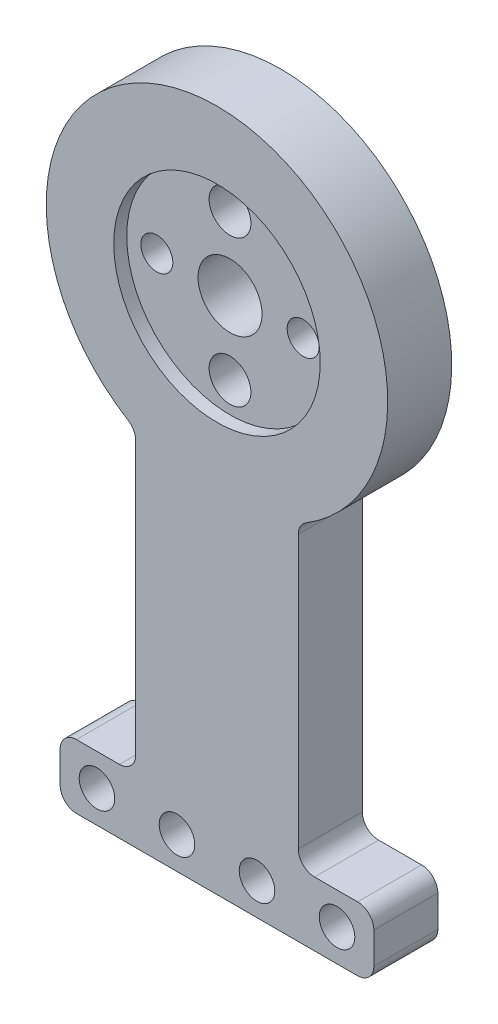
from build123d import *

# Parameters (mm, degrees)
SKETCH1_R                                           = 4.9975
BOSS_EXTRUDE1_DEPTH                                 = 4.999999995
SKETCH5_R                                           = 16.129
CUT_EXTRUDE2_DEPTH                                  = 2.032
F_5_0MM_DOWEL_HOLE1_D                               = 5
F_5_0MM_DOWEL_HOLE1_DEPTH                           = 16.51
F_5_0MM_DOWEL_HOLE1_TIP                             = 1.502151548
CSK_FOR_1_4_FLAT_HEAD_MACHINE_SCREW_100_D           = 6.5278
CSK_FOR_1_4_FLAT_HEAD_MACHINE_SCREW_100_DEPTH       = 16.51
CSK_FOR_1_4_FLAT_HEAD_MACHINE_SCREW_100_CSINK_D     = 12.8778
CSK_FOR_1_4_FLAT_HEAD_MACHINE_SCREW_100_CSINK_ANGLE = 100
CSK_FOR_1_4_FLAT_HEAD_MACHINE_SCREW_100_TIP         = 1.961148974
SKETCH26_W                                          = 9.99999999
SKETCH26_H                                          = 10.000000066
BOSS_EXTRUDE2_DEPTH                                 = 24.500000022
FILLET1_R                                           = 2.54
F_7_32_0_21875_DIAMETER_HOLE1_D                     = 5.55625
F_7_32_0_21875_DIAMETER_HOLE1_DEPTH                 = 16.51
F_7_32_0_21875_DIAMETER_HOLE1_TIP                   = 1.669265907


with BuildPart() as part:
    # Sketch1 → Boss-Extrude1 (new, symmetric)
    with BuildSketch(Plane.XY):
        with BuildLine():
            Line((-12.7, -80.01), (12.7, -80.01))
            Line((12.7, -80.01), (12.7, -23.452055347))
            ThreePointArc((12.7, -23.452055347), (0, 26.67), (-12.7, -23.452055347))
            Line((-12.7, -23.452055347), (-12.7, -80.01))
        make_face()
        Circle(SKETCH1_R, mode=Mode.SUBTRACT)
    extrude(amount=BOSS_EXTRUDE1_DEPTH, both=True)

    # Sketch5 → Cut-Extrude2 (cut)
    with BuildSketch(Plane.XY.offset(4.999999995)):
        Circle(SKETCH5_R)
    extrude(amount=-CUT_EXTRUDE2_DEPTH, mode=Mode.SUBTRACT)

    # Ø5.0mm Dowel Hole1
    with Locations(Plane(origin=(11.43, 0, -4.999999995), x_dir=(-1, 0, 0), z_dir=(0, 0, -1))):
        with Locations((0, 0), (22.86, 0)):
            Hole(F_5_0MM_DOWEL_HOLE1_D / 2, depth=F_5_0MM_DOWEL_HOLE1_DEPTH)
            with Locations((0, 0, -(F_5_0MM_DOWEL_HOLE1_DEPTH + F_5_0MM_DOWEL_HOLE1_TIP / 2))):  # 118° drill point
                Cone(0, F_5_0MM_DOWEL_HOLE1_D / 2, F_5_0MM_DOWEL_HOLE1_TIP, mode=Mode.SUBTRACT)

    # CSK for 1/4 Flat Head Machine Screw (100)1
    with Locations(Plane(origin=(0, 11.43, -4.999999995), x_dir=(-1, 0, 0), z_dir=(0, 0, -1))):
        with Locations((0, 0), (0, -22.86)):
            CounterSinkHole(CSK_FOR_1_4_FLAT_HEAD_MACHINE_SCREW_100_D / 2, CSK_FOR_1_4_FLAT_HEAD_MACHINE_SCREW_100_CSINK_D / 2, depth=CSK_FOR_1_4_FLAT_HEAD_MACHINE_SCREW_100_DEPTH, counter_sink_angle=CSK_FOR_1_4_FLAT_HEAD_MACHINE_SCREW_100_CSINK_ANGLE)
            with Locations((0, 0, -(CSK_FOR_1_4_FLAT_HEAD_MACHINE_SCREW_100_DEPTH + CSK_FOR_1_4_FLAT_HEAD_MACHINE_SCREW_100_TIP / 2))):  # 118° drill point
                Cone(0, CSK_FOR_1_4_FLAT_HEAD_MACHINE_SCREW_100_D / 2, CSK_FOR_1_4_FLAT_HEAD_MACHINE_SCREW_100_TIP, mode=Mode.SUBTRACT)

    # Sketch26 → Boss-Extrude2 (add, symmetric)
    with BuildSketch(Plane(origin=(0, 0, 0), x_dir=(0, 0, -1), z_dir=(1, 0, 0))):
        with Locations((0, -75.009999967)):
            Rectangle(SKETCH26_W, SKETCH26_H)
    extrude(amount=BOSS_EXTRUDE2_DEPTH, both=True)

    # Fillet1
    fillet1_edges = [part.edges().sort_by_distance(p)[0] for p in [
        (12.7, -23.452055347, 0),
        (12.7, -70.009999934, 0),
        (-12.7, -23.452055347, 0),
        (-12.7, -70.009999934, 0),
        (-24.500000022, -70.009999934, 0),
        (-24.500000022, -80.01, 0),
        (24.500000022, -70.009999934, 0),
        (24.500000022, -80.01, 0),
    ]]
    fillet(fillet1_edges, radius=FILLET1_R)

    # 7/32 (0.21875) Diameter Hole1
    with Locations(Plane(origin=(-18.749999584, -75.009999967, -4.999999995), x_dir=(-1, 0, 0), z_dir=(0, 0, -1))):
        with Locations((0, 0), (-12.499999892, 0), (-24.999999784, 0), (-37.499999676, 0)):
            Hole(F_7_32_0_21875_DIAMETER_HOLE1_D / 2, depth=F_7_32_0_21875_DIAMETER_HOLE1_DEPTH)
            with Locations((0, 0, -(F_7_32_0_21875_DIAMETER_HOLE1_DEPTH + F_7_32_0_21875_DIAMETER_HOLE1_TIP / 2))):  # 118° drill point
                Cone(0, F_7_32_0_21875_DIAMETER_HOLE1_D / 2, F_7_32_0_21875_DIAMETER_HOLE1_TIP, mode=Mode.SUBTRACT)


solid = part.part
